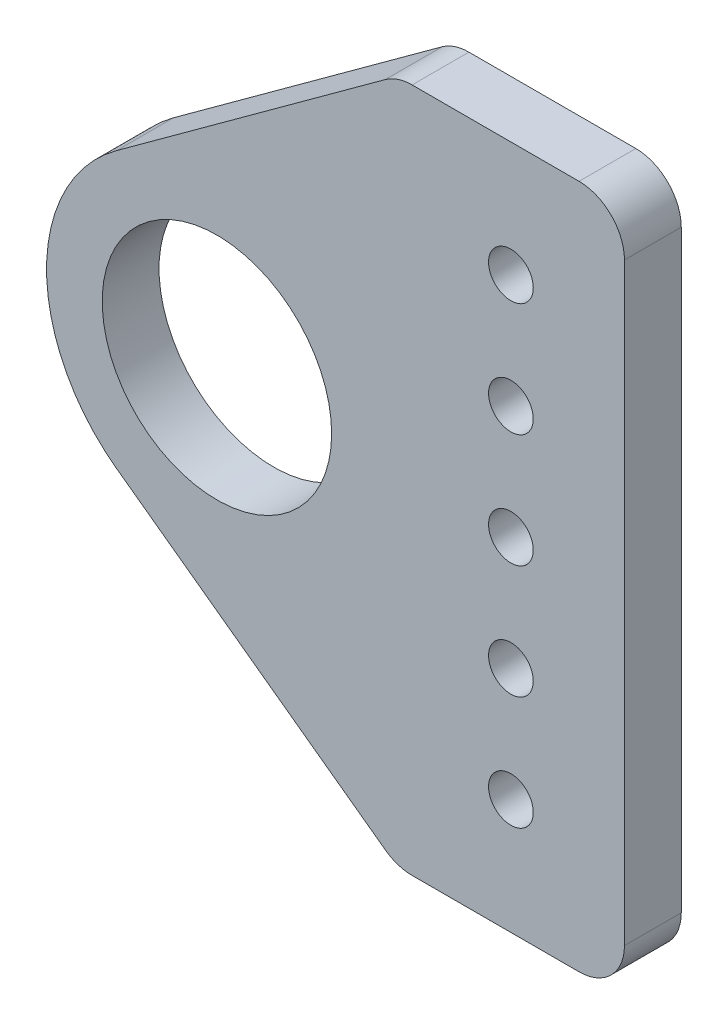
from build123d import *

# Parameters (mm, degrees)
SKETCH1_R           = 12.827
SKETCH1_R_2         = 2.5
BOSS_EXTRUDE1_DEPTH = 6.35


with BuildPart() as part:
    # Sketch1 → Boss-Extrude1 (new body)
    with BuildSketch(Plane.XY):
        with BuildLine():
            Line((7.62, 952.678814448), (-11.045005757, 952.678814448))
            ThreePointArc((-11.045005757, 952.678814448), (-12.618597572, 952.428949933), (-14.037392239, 951.703936022))
            Line((-14.037392239, 951.703936022), (-44.094373957, 929.794205904))
            ThreePointArc((-44.094373957, 929.794205904), (-51.922924648, 914.4), (-44.094373957, 899.005794096))
            Line((-44.094373957, 899.005794096), (-14.037392239, 877.096063978))
            ThreePointArc((-14.037392239, 877.096063978), (-12.618597572, 876.371050067), (-11.045005757, 876.121185552))
            Line((-11.045005757, 876.121185552), (7.62, 876.121185552))
            ThreePointArc((7.62, 876.121185552), (11.212102448, 877.609083104), (12.7, 881.201185552))
            Line((12.7, 881.201185552), (12.7, 947.598814448))
            ThreePointArc((12.7, 947.598814448), (11.212102448, 951.190916896), (7.62, 952.678814448))
        make_face()
        with Locations((-32.872924648, 914.4)):
            Circle(SKETCH1_R, mode=Mode.SUBTRACT)
        with Locations((0, 939.8)):
            Circle(SKETCH1_R_2, mode=Mode.SUBTRACT)
        with Locations((0, 927.1)):
            Circle(SKETCH1_R_2, mode=Mode.SUBTRACT)
        with Locations((0, 914.4)):
            Circle(SKETCH1_R_2, mode=Mode.SUBTRACT)
        with Locations((0, 901.7)):
            Circle(SKETCH1_R_2, mode=Mode.SUBTRACT)
        with Locations((0, 889)):
            Circle(SKETCH1_R_2, mode=Mode.SUBTRACT)
    extrude(amount=BOSS_EXTRUDE1_DEPTH)


solid = part.part
